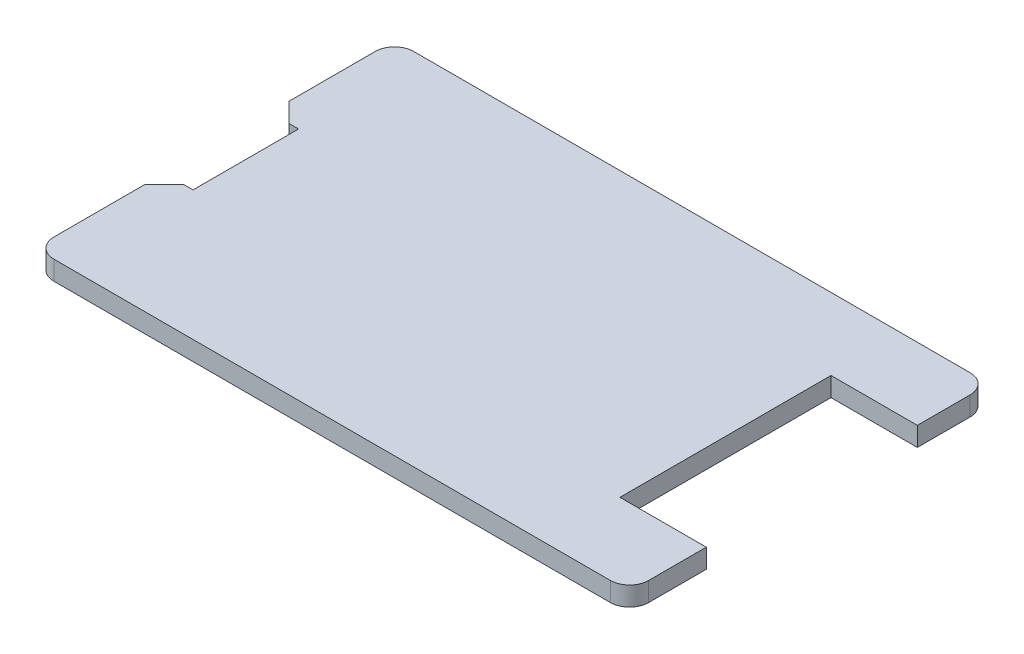
from build123d import *

# Parameters (mm, degrees)
BOSS_EXTRUDE1_DEPTH = 2
SKETCH3_W           = 3
SKETCH3_H           = 11
CUT_EXTRUDE1_DEPTH  = 2
CHAMFER1_SIZE       = 2
SKETCH4_W           = 9
SKETCH4_H           = 22
CUT_EXTRUDE2_DEPTH  = 2


with BuildPart() as part:
    # Sketch1 → Boss-Extrude1 (new body)
    with BuildSketch(Plane(origin=(0, 0, 0), x_dir=(1, 0, 0), z_dir=(0, 1, 0))):
        with BuildLine():
            Line((-29.25, -24.848942598), (28.75, -24.848942598))
            ThreePointArc((28.75, -24.848942598), (30.164213562, -24.263156161), (30.75, -22.848942598))
            Line((30.75, -22.848942598), (30.75, 10.651057402))
            ThreePointArc((30.75, 10.651057402), (30.164213562, 12.065270964), (28.75, 12.651057402))
            Line((28.75, 12.651057402), (-29.25, 12.651057402))
            ThreePointArc((-29.25, 12.651057402), (-30.664213562, 12.065270964), (-31.25, 10.651057402))
            Line((-31.25, 10.651057402), (-31.25, -22.848942598))
            ThreePointArc((-31.25, -22.848942598), (-30.664213562, -24.263156161), (-29.25, -24.848942598))
        make_face()
    extrude(amount=BOSS_EXTRUDE1_DEPTH)

    # Sketch3 → Cut-Extrude1 (cut)
    with BuildSketch(Plane(origin=(0, 2, 0), x_dir=(1, 0, 0), z_dir=(0, 1, 0))):
        with Locations((-29.75, -5.848942598)):
            Rectangle(SKETCH3_W, SKETCH3_H)
    extrude(amount=-CUT_EXTRUDE1_DEPTH, mode=Mode.SUBTRACT)

    # Chamfer1
    chamfer1_edges = [part.edges().sort_by_distance(p)[0] for p in [
        (-31.25, 1, 11.348942598),
        (-31.25, 1, 0.348942598),
    ]]
    chamfer(chamfer1_edges, length=CHAMFER1_SIZE)

    # Sketch4 → Cut-Extrude2 (cut)
    with BuildSketch(Plane(origin=(0, 2, 0), x_dir=(1, 0, 0), z_dir=(0, 1, 0))):
        with Locations((26.25, -5.848942598)):
            Rectangle(SKETCH4_W, SKETCH4_H)
    extrude(amount=-CUT_EXTRUDE2_DEPTH, mode=Mode.SUBTRACT)


solid = part.part
